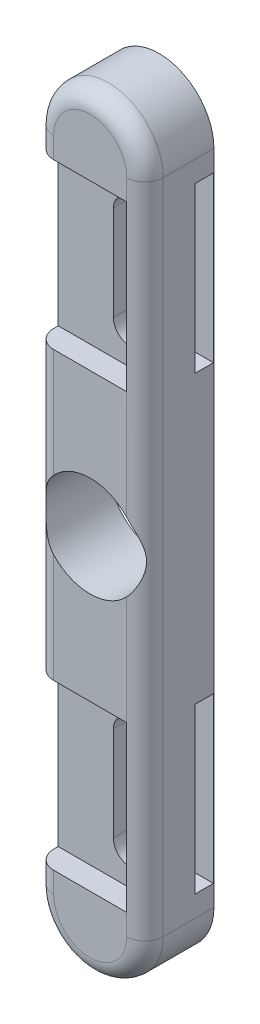
from build123d import *

# Parameters (mm, degrees)
SALIENTE_EXTRUIR1_DEPTH = 7.55
REDONDEO1_R             = 2
CROQUIS2_W              = 16.065204313
CROQUIS2_H              = 18
CORTAR_EXTRUIR1_DEPTH   = 2.5
CROQUIS3_R              = 5.5
CORTAR_EXTRUIR2_DEPTH   = 97.304594979
CROQUIS4_W              = 2
CROQUIS4_H              = 18
CORTAR_EXTRUIR3_DEPTH   = 6.5
CORTAR_EXTRUIR4_DEPTH   = 97.140912353


with BuildPart() as part:
    # Croquis1 → Saliente-Extruir1 (new body)
    with BuildSketch(Plane.XY):
        with BuildLine():
            Line((52.9, -7.25), (52.9, 64.75))
            ThreePointArc((52.9, 64.75), (58.9, 70.75), (64.9, 64.75))
            Line((64.9, 64.75), (64.9, -7.25))
            ThreePointArc((64.9, -7.25), (58.9, -13.25), (52.9, -7.25))
        make_face()
    extrude(amount=SALIENTE_EXTRUIR1_DEPTH)

    # Redondeo1
    redondeo1_edges = [part.edges().sort_by_distance(p)[0] for p in [
        (58.9, 70.75, 7.55),
        (64.9, 28.75, 7.55),
        (58.9, -13.25, 7.55),
        (52.9, 28.75, 7.55),
    ]]
    fillet(redondeo1_edges, radius=REDONDEO1_R)

    # Croquis2 → Cortar-Extruir1 (cut)
    with BuildSketch(Plane.XY.offset(7.55)):
        with Locations((54.867397844, 4.055228902)):
            Rectangle(CROQUIS2_W, CROQUIS2_H)
        with Locations((54.867397844, 53.444771098)):
            Rectangle(CROQUIS2_W, CROQUIS2_H)
    extrude(amount=-CORTAR_EXTRUIR1_DEPTH, mode=Mode.SUBTRACT)

    # Croquis3 → Cortar-Extruir2 (cut, through all)
    with BuildSketch(Plane.XY.offset(7.55)):
        with Locations((58.9, 28.75)):
            Circle(CROQUIS3_R)
    extrude(amount=-CORTAR_EXTRUIR2_DEPTH, mode=Mode.SUBTRACT)

    # Croquis4 → Cortar-Extruir3 (cut)
    with BuildSketch(Plane(origin=(64.9, 0, 0), x_dir=(0, 0, -1), z_dir=(1, 0, 0))):
        with Locations((-1.05, 4.055228902)):
            Rectangle(CROQUIS4_W, CROQUIS4_H)
        with Locations((-1.05, 53.444771098)):
            Rectangle(CROQUIS4_W, CROQUIS4_H)
    extrude(amount=-CORTAR_EXTRUIR3_DEPTH, mode=Mode.SUBTRACT)

    # Croquis5 → Cortar-Extruir4 (cut, through all)
    with BuildSketch(Plane.XY.offset(5.05)):
        with BuildLine():
            Line((62.541, 9.245228902), (62.541, -1.134771098))
            ThreePointArc((62.541, -1.134771098), (60.741, -2.934771098), (58.941, -1.134771098))
            Line((58.941, -1.134771098), (58.941, 9.245228902))
            ThreePointArc((58.941, 9.245228902), (60.741, 11.045228902), (62.541, 9.245228902))
        make_face()
        with BuildLine():
            Line((62.541, 48.254771098), (62.541, 58.634771098))
            ThreePointArc((62.541, 58.634771098), (60.741, 60.434771098), (58.941, 58.634771098))
            Line((58.941, 58.634771098), (58.941, 48.254771098))
            ThreePointArc((58.941, 48.254771098), (60.741, 46.454771098), (62.541, 48.254771098))
        make_face()
    extrude(amount=-CORTAR_EXTRUIR4_DEPTH, mode=Mode.SUBTRACT)


solid = part.part
